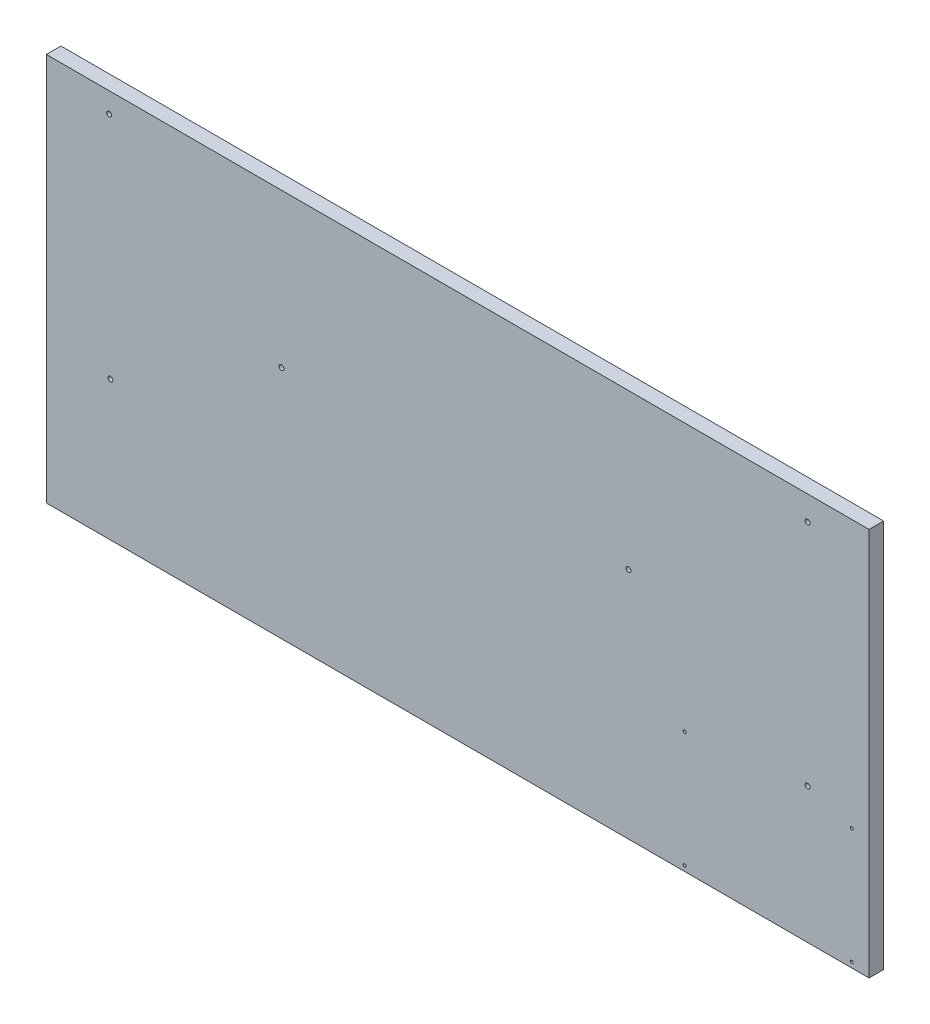
from build123d import *

# Parameters (mm, degrees)
ESBO_O1_W                = 845
ESBO_O1_H                = 399
RESSALTO_EXTRUS_O1_DEPTH = 15
ESBO_O2_R                = 2.5
CORTE_EXTRUS_O1_DEPTH    = 10
ESBO_O3_R                = 1.5
CORTE_EXTRUS_O2_DEPTH    = 10
ESBO_O4_R                = 1.5
CORTE_EXTRUS_O3_DEPTH    = 468.473528662


with BuildPart() as part:
    # Esboço1 → Ressalto-extrusão1 (new body)
    with BuildSketch(Plane.XY):
        Rectangle(ESBO_O1_W, ESBO_O1_H)
    extrude(amount=RESSALTO_EXTRUS_O1_DEPTH)

    # Esboço2 → Corte-extrusão1 (cut)
    with BuildSketch(Plane.XY.offset(15)):
        with Locations((-358, 178.7)):
            Circle(ESBO_O2_R)
        with Locations((-356.7, -56.3)):
            Circle(ESBO_O2_R)
        with Locations((-181, 41.7)):
            Circle(ESBO_O2_R)
        with Locations((359.4, -60.3)):
            Circle(ESBO_O2_R)
        with Locations((359.4, 174.5)):
            Circle(ESBO_O2_R)
        with Locations((175.4, 40.3)):
            Circle(ESBO_O2_R)
    extrude(amount=-CORTE_EXTRUS_O1_DEPTH, mode=Mode.SUBTRACT)

    # Esboço3 → Corte-extrusão2 (cut)
    with BuildSketch(Plane.XY.offset(15)):
        with Locations((233, -75.1)):
            Circle(ESBO_O3_R)
        with Locations((404.7, -75.1)):
            Circle(ESBO_O3_R)
    extrude(amount=-CORTE_EXTRUS_O2_DEPTH, mode=Mode.SUBTRACT)

    # Esboço4 → Corte-extrusão3 (cut, through all)
    with BuildSketch(Plane.XY.offset(15)):
        with Locations((233, -194.1)):
            Circle(ESBO_O4_R)
        with Locations((404.7, -194.1)):
            Circle(ESBO_O4_R)
    extrude(amount=-CORTE_EXTRUS_O3_DEPTH, mode=Mode.SUBTRACT)


solid = part.part
